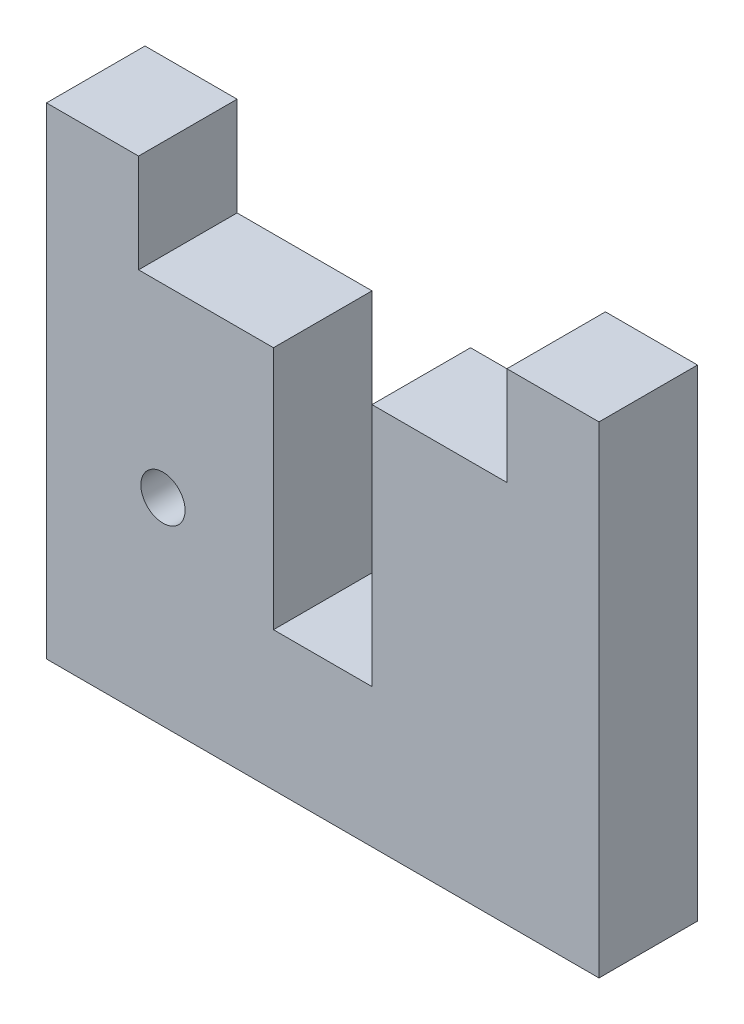
from build123d import *

# Parameters (mm, degrees)
MODEL_R             = 1.2
BOSS_EXTRUDE1_DEPTH = 5.35


with BuildPart() as part:
    # Model → Boss-Extrude1 (new body)
    with BuildSketch(Plane.XY):
        Polygon((10, 26.15), (15, 26.15), (15, 0), (-15, 0), (-15, 26.15), (-10, 26.15), (-10, 20.8), (-2.675, 20.8), (-2.675, 7.539774624), (2.675, 7.539774624), (2.675, 20.8), (10, 20.8), align=None)
        with Locations((-8.675, 10.75)):
            Circle(MODEL_R, mode=Mode.SUBTRACT)
    extrude(amount=BOSS_EXTRUDE1_DEPTH)


solid = part.part
